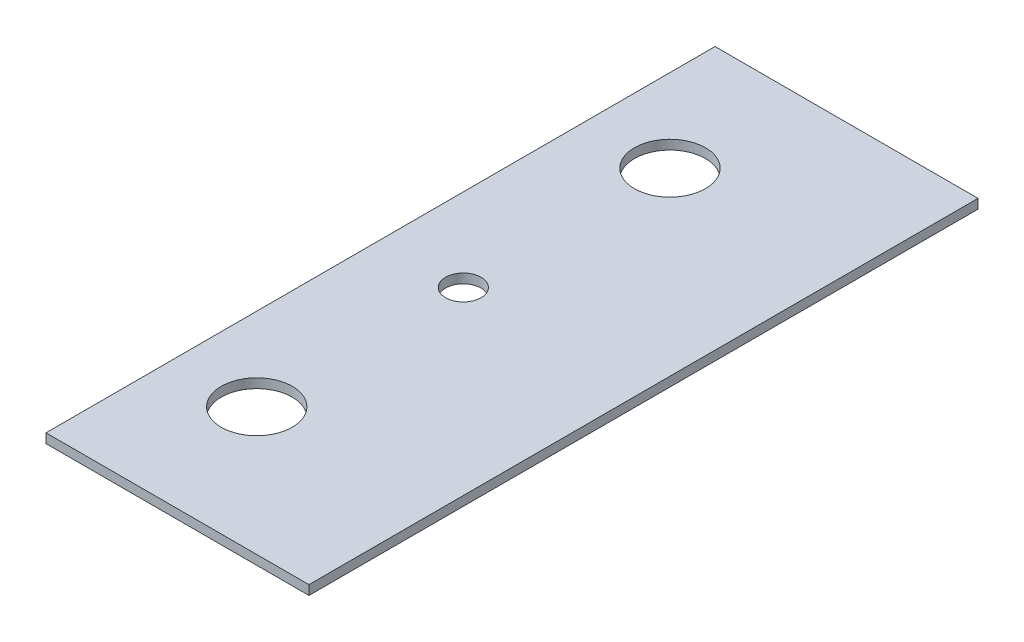
from build123d import *

# Parameters (mm, degrees)
SKETCH1_W           = 22.225
SKETCH1_H           = 56.55
SKETCH1_R           = 1.5
SKETCH1_R_2         = 3
BOSS_EXTRUDE1_DEPTH = 0.79375


with BuildPart() as part:
    # Sketch1 → Boss-Extrude1 (new body)
    with BuildSketch(Plane(origin=(0, 0, 0), x_dir=(1, 0, 0), z_dir=(0, 1, 0))):
        with Locations((93.614649254, -89.26803402)):
            Rectangle(SKETCH1_W, SKETCH1_H)
        with Locations(Location((89.502149254, -89.26803402, 0), (0, 0, 270))):
            Circle(SKETCH1_R, mode=Mode.SUBTRACT)
        with Locations(Location((89.502149254, -71.80553402, 0), (0, 0, 270))):
            Circle(SKETCH1_R_2, mode=Mode.SUBTRACT)
        with Locations(Location((89.502149254, -106.73053402, 0), (0, 0, 270))):
            Circle(SKETCH1_R_2, mode=Mode.SUBTRACT)
    extrude(amount=BOSS_EXTRUDE1_DEPTH)


solid = part.part
